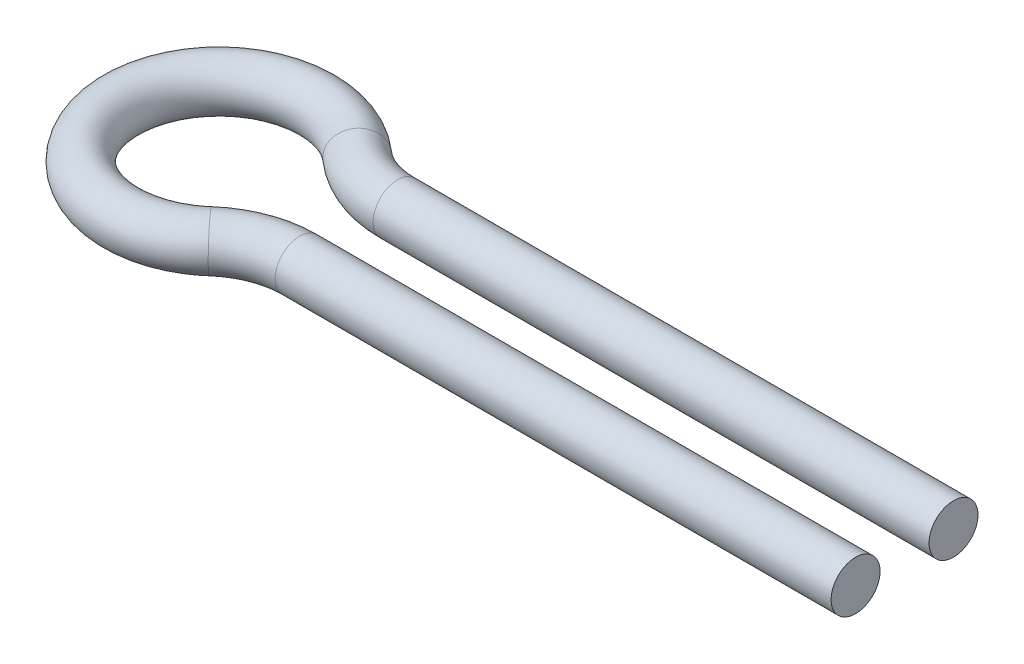
from build123d import *

# Parameters (mm, degrees)
SKETCH_3_R = 2.5


with BuildPart() as part:
    # 扫描2: sweep along a path in 草图1
    with BuildLine(Plane(origin=(0, 0, 0), x_dir=(1, 0, 0), z_dir=(0, 1, 0))) as sweep_2_path:
        Line((70, 5), (13.228756555, 5))
        ThreePointArc((13.228756555, 5), (9.693222649, 5.645856533), (6.614378278, 7.5))
        ThreePointArc((6.614378278, 7.5), (-10, 0), (6.614378278, -7.5))
        ThreePointArc((6.614378278, -7.5), (9.693222649, -5.645856533), (13.228756555, -5))
        Line((13.228756555, -5), (70, -5))
    # 草图3 → 扫描2 (sweep)
    with BuildSketch(Plane(origin=(70, 0, 0), x_dir=(0, 0, -1), z_dir=(1, 0, 0))):
        with Locations((5, 0)):
            Circle(SKETCH_3_R)
    sweep(path=sweep_2_path.line)


solid = part.part
